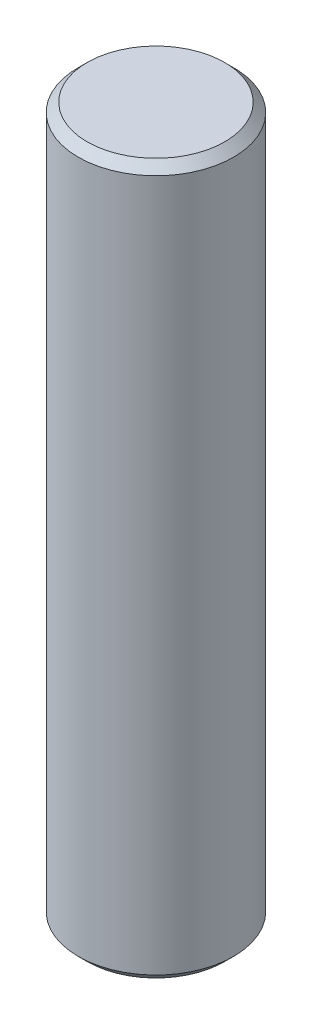
from build123d import *

# Parameters (mm, degrees)
SKETCH_1_R      = 1.75
EXTRUDE_1_DEPTH = 16
CHAMFER_1_SIZE  = 0.2


with BuildPart() as part:
    # 草图1 → 凸台-拉伸1 (new body)
    with BuildSketch(Plane(origin=(0, 0, 0), x_dir=(1, 0, 0), z_dir=(0, 1, 0))):
        with Locations(Location((0, 0, 0), (0, 0, 270))):
            Circle(SKETCH_1_R)
    extrude(amount=EXTRUDE_1_DEPTH)

    # 倒角1
    chamfer_1_edges = [part.edges().sort_by_distance(p)[0] for p in [
        (0, 0, -1.75),
        (0, 16, -1.75),
    ]]
    chamfer(chamfer_1_edges, length=CHAMFER_1_SIZE)


solid = part.part
